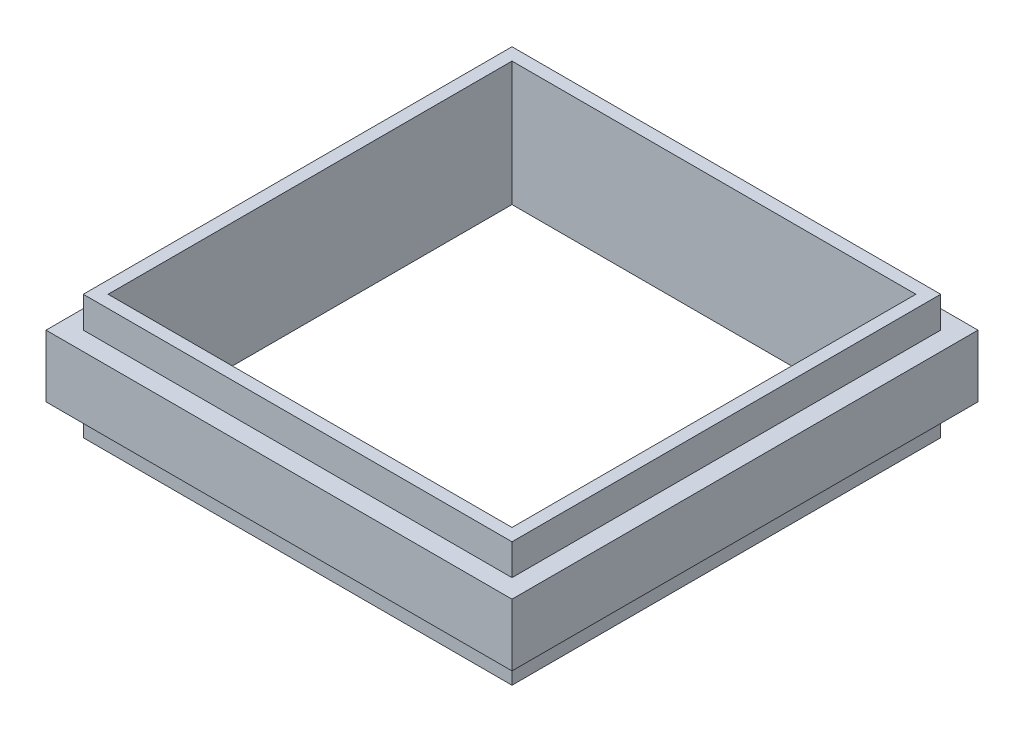
from build123d import *

# Parameters (mm, degrees)
SKETCH_1_W          = 150
SKETCH_1_H          = 150
EXTRUDE_1_DEPTH     = 20
SKETCH_2_W          = 138
SKETCH_2_H          = 138
EXTRUDE_2_DEPTH     = 10
SKETCH_3_W          = 138
SKETCH_3_H          = 138
EXTRUDE_3_DEPTH     = 10
SKETCH_4_W          = 130
SKETCH_4_H          = 130
CUT_EXTRUDE_1_DEPTH = 114.357840488


with BuildPart() as part:
    # Эскиз1 → Бобышка-Вытянуть1 (new body)
    with BuildSketch(Plane(origin=(0, 0, 0), x_dir=(1, 0, 0), z_dir=(0, 1, 0))):
        Rectangle(SKETCH_1_W, SKETCH_1_H)
    extrude(amount=EXTRUDE_1_DEPTH)

    # Эскиз2 → Бобышка-Вытянуть2 (add)
    with BuildSketch(Plane(origin=(0, 20, 0), x_dir=(1, 0, 0), z_dir=(0, 1, 0))):
        Rectangle(SKETCH_2_W, SKETCH_2_H)
    extrude(amount=EXTRUDE_2_DEPTH)

    # Эскиз3 → Бобышка-Вытянуть3 (add)
    with BuildSketch(Plane(origin=(0, 0, 0), x_dir=(-1, 0, 0), z_dir=(0, -1, 0))):
        Rectangle(SKETCH_3_W, SKETCH_3_H)
    extrude(amount=EXTRUDE_3_DEPTH)

    # Эскиз4 → Вырез-Вытянуть1 (cut, through all)
    with BuildSketch(Plane(origin=(0, 30, 0), x_dir=(1, 0, 0), z_dir=(0, 1, 0))):
        Rectangle(SKETCH_4_W, SKETCH_4_H)
    extrude(amount=-CUT_EXTRUDE_1_DEPTH, mode=Mode.SUBTRACT)


solid = part.part
